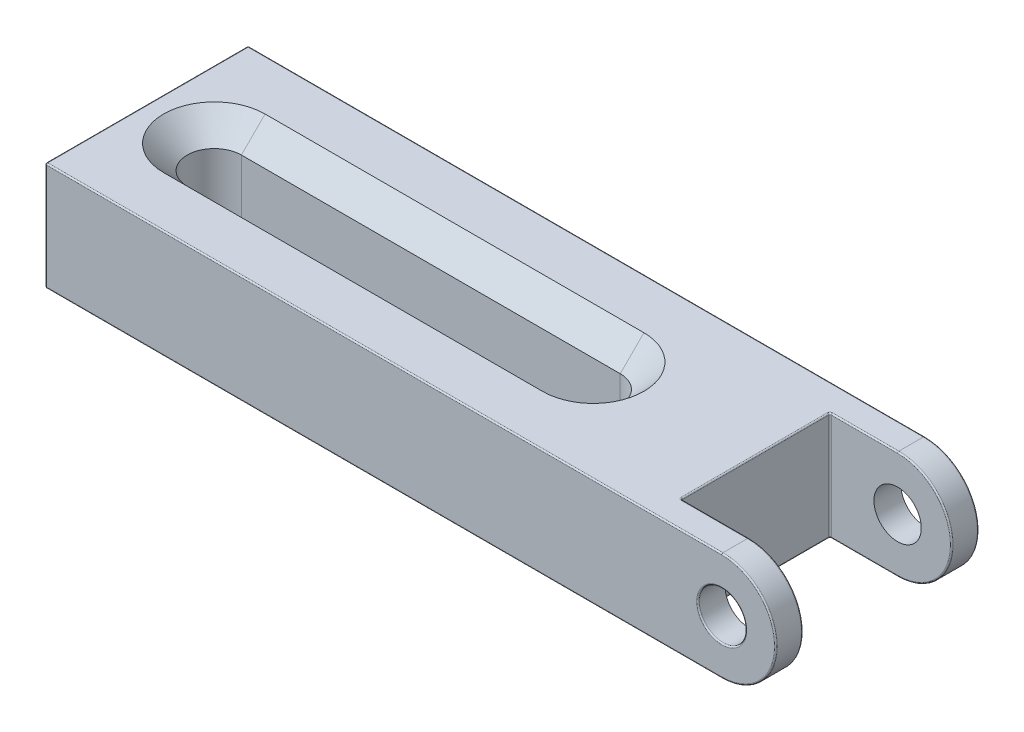
from build123d import *

# Parameters (mm, degrees)
SKETCH1_R           = 1.75
BOSS_EXTRUDE1_DEPTH = 7.5
SKETCH2_W           = 9
SKETCH2_H           = 11
CUT_EXTRUDE1_DEPTH  = 56.102177815
CUT_EXTRUDE2_DEPTH  = 56.102177815
FILLET1_R           = 0.1
CHAMFER1_SIZE       = 1.75


with BuildPart() as part:
    # Sketch1 → Boss-Extrude1 (new, symmetric)
    with BuildSketch(Plane.XY):
        with BuildLine():
            Line((0, 4), (50, 4))
            ThreePointArc((50, 4), (54, 0), (50, -4))
            Line((50, -4), (0, -4))
            Line((0, -4), (0, 4))
        make_face()
        with Locations((50, 0)):
            Circle(SKETCH1_R, mode=Mode.SUBTRACT)
    extrude(amount=BOSS_EXTRUDE1_DEPTH, both=True)

    # Sketch2 → Cut-Extrude1 (cut, through all)
    with BuildSketch(Plane(origin=(0, 4, 0), x_dir=(1, 0, 0), z_dir=(0, 1, 0))):
        with Locations((49.5, 0)):
            Rectangle(SKETCH2_W, SKETCH2_H)
    extrude(amount=-CUT_EXTRUDE1_DEPTH, mode=Mode.SUBTRACT)

    # Sketch3 → Cut-Extrude2 (cut, through all)
    with BuildSketch(Plane(origin=(0, 4, 0), x_dir=(1, 0, 0), z_dir=(0, 1, 0))):
        with BuildLine():
            Line((5, 2), (33, 2))
            ThreePointArc((33, 2), (35, 0), (33, -2))
            Line((33, -2), (5, -2))
            ThreePointArc((5, -2), (3, 0), (5, 2))
        make_face()
    extrude(amount=-CUT_EXTRUDE2_DEPTH, mode=Mode.SUBTRACT)

    # Fillet1
    fillet1_edges = [part.edges().sort_by_distance(p)[0] for p in [
        (48.25, 0, 7.5),
        (54, 0, 7.5),
        (25, 4, 7.5),
        (54, 0, 5.5),
        (47.5, -4, 5.5),
        (54, 0, -5.5),
        (47.5, -4, -5.5),
        (45, 0, -5.5),
        (45, -4, 0),
        (45, 0, 5.5),
        (47.5, 4, 5.5),
        (47.5, 4, -5.5),
        (45, 4, 0),
        (0, 0, 7.5),
        (25, 4, -7.5),
        (3, -4, 0),
        (19, -4, -2),
        (35, -4, 0),
        (19, -4, 2),
        (54, 0, -7.5),
        (25, -4, -7.5),
        (0, 0, -7.5),
        (0, 4, 0),
        (0, -4, 0),
        (25, -4, 7.5),
    ]]
    fillet(fillet1_edges, radius=FILLET1_R)

    # Chamfer1
    chamfer1_edges = [part.edges().sort_by_distance(p)[0] for p in [
        (3, 4, 0),
        (19, 4, 2),
        (35, 4, 0),
        (19, 4, -2),
    ]]
    chamfer(chamfer1_edges, length=CHAMFER1_SIZE)


solid = part.part
